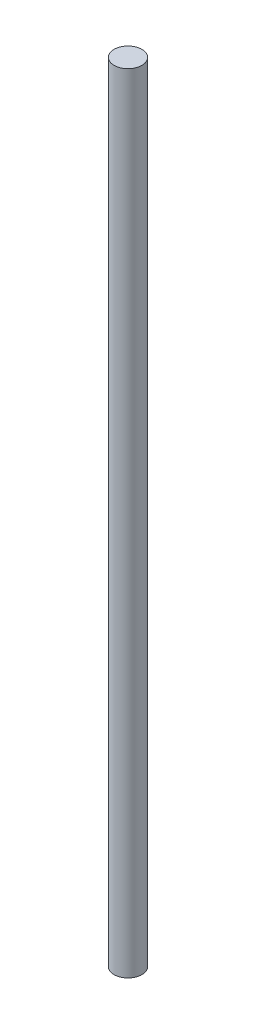
from build123d import *

# Parameters (mm, degrees)
SKETCH1_R           = 6
BOSS_EXTRUDE1_DEPTH = 340


with BuildPart() as part:
    # Sketch1 → Boss-Extrude1 (new body)
    with BuildSketch(Plane(origin=(0, 0, 0), x_dir=(1, 0, 0), z_dir=(0, 1, 0))):
        with Locations(Location((0, 0, 0), (0, 0, 270))):
            Circle(SKETCH1_R)
    extrude(amount=BOSS_EXTRUDE1_DEPTH)


solid = part.part
